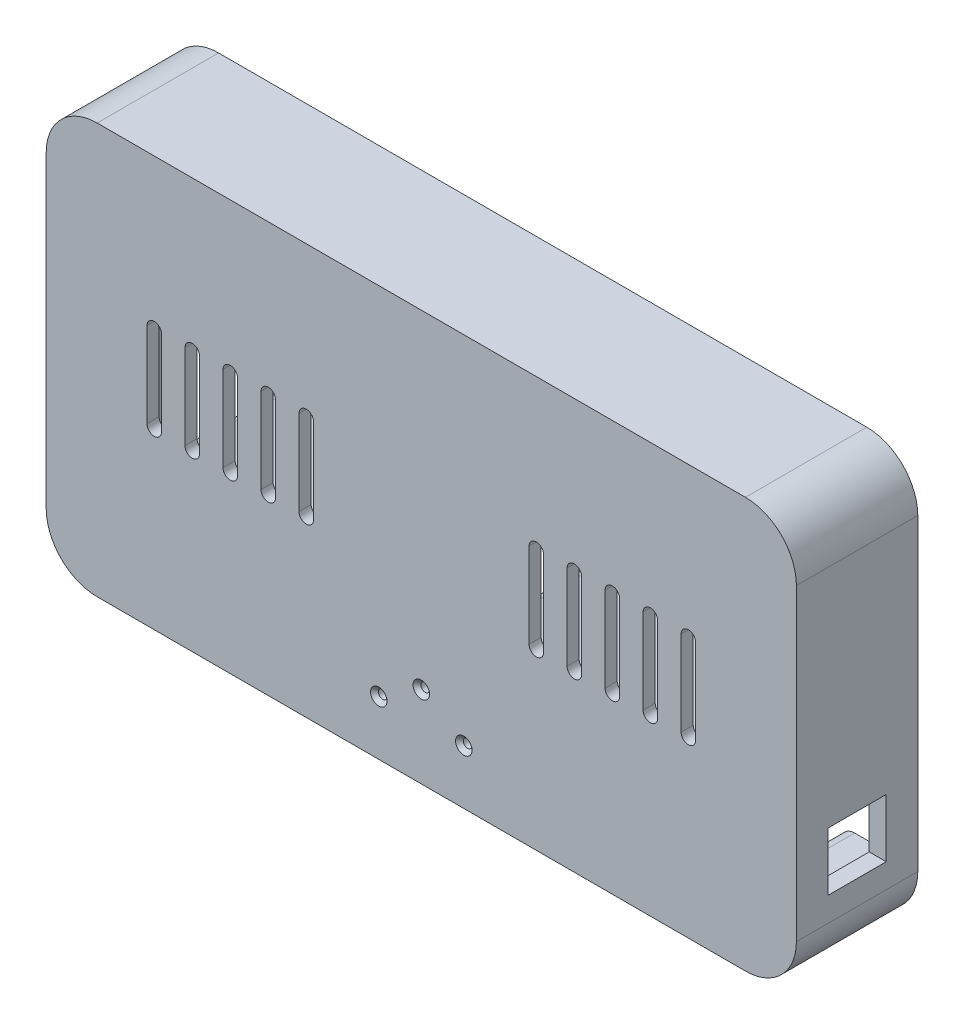
from build123d import *

# Parameters (mm, degrees)
EXTRUDE_1_DEPTH              = 50
CUT_EXTRUDE_1_DEPTH          = 45
CUT_EXTRUDE_2_DEPTH          = 5
CUT_EXTRUDE_3_DEPTH          = 5
SKETCH_1_7_R                 = 3.25
CUT_EXTRUDE_4_DEPTH          = 25
USB_REACH                    = 236.374
SKETCH_14_R                  = 1.6
SKETCH_14_W                  = 14
SKETCH_14_H                  = 9
CUT_EXTRUDE_12_REACH         = 326.224
SKETCH_16_W                  = 24
SKETCH_16_H                  = 24
CUT_EXTRUDE_13_REACH         = 326.224
SKETCH_18_W                  = 24
SKETCH_18_H                  = 24
EXTRUDE_2_DEPTH              = 40
SKETCH_29_4_R                = 2.85
EXTRUDE_4_DEPTH              = 5
SKETCH_29_5_R                = 3.4
SKETCH_29_5_R_2              = 1.2
EXTRUDE_5_DEPTH              = 6.5
CUT_EXTRUDE_START            = -2
SKETCH_29_R                  = 1.2
CUT_EXTRUDE_14_DEPTH         = 2
SKETCH_30_R                  = 1.6
CUT_EXTRUDE_21_DEPTH         = 5
HOLE_WIZARD_M3_1_D           = 3.6
HOLE_WIZARD_M3_1_CSINK_D     = 6.8
HOLE_WIZARD_M3_1_CSINK_ANGLE = 90
CUT_EXTRUDE_23_REACH         = 183.757
FILLET_1_R                   = 5


with BuildPart() as part:
    # 草图1 → 凸台-拉伸1 (new body)
    with BuildSketch(Plane.XY):
        with BuildLine():
            Line((-133.5, 84.5), (133.5, 84.5))
            ThreePointArc((133.5, 84.5), (148.349242405, 78.349242405), (154.5, 63.5))
            Line((154.5, 63.5), (154.5, -63.5))
            ThreePointArc((154.5, -63.5), (148.349242405, -78.349242405), (133.5, -84.5))
            Line((133.5, -84.5), (-133.5, -84.5))
            ThreePointArc((-133.5, -84.5), (-148.349242405, -78.349242405), (-154.5, -63.5))
            Line((-154.5, -63.5), (-154.5, 63.5))
            ThreePointArc((-154.5, 63.5), (-148.349242405, 78.349242405), (-133.5, 84.5))
        make_face()
    extrude(amount=EXTRUDE_1_DEPTH)

    # 草图1<4> → 切除-拉伸1 (cut)
    with BuildSketch(Plane.XY):
        with BuildLine():
            Line((127.75, 77.5), (-127.65, 77.5))
            Line((-127.65, 77.5), (-127.65, 63.5))
            ThreePointArc((-127.65, 63.5), (-129.36342533, 59.36342533), (-133.5, 57.65))
            Line((-133.5, 57.65), (-147.5, 57.65))
            Line((-147.5, 57.65), (-147.5, -57.65))
            Line((-147.5, -57.65), (-133.5, -57.65))
            ThreePointArc((-133.5, -57.65), (-129.36342533, -59.36342533), (-127.65, -63.5))
            Line((-127.65, -63.5), (-127.65, -77.5))
            Line((-127.65, -77.5), (127.75, -77.5))
            Line((127.75, -77.5), (127.75, -63.5))
            ThreePointArc((127.75, -63.5), (129.434136008, -59.434136008), (133.5, -57.75))
            Line((133.5, -57.75), (147.5, -57.75))
            Line((147.5, -57.75), (147.5, 57.75))
            Line((147.5, 57.75), (133.5, 57.75))
            ThreePointArc((133.5, 57.75), (129.434136008, 59.434136008), (127.75, 63.5))
            Line((127.75, 63.5), (127.75, 77.5))
        make_face()
    extrude(amount=CUT_EXTRUDE_1_DEPTH, mode=Mode.SUBTRACT)

    # 草图1<5> → 切除-拉伸2 (cut)
    with BuildSketch(Plane.XY):
        with BuildLine():
            ThreePointArc((-150.2, 63.5), (-145.308683246, 75.308683246), (-133.5, 80.2))
            Line((-133.5, 80.2), (133.5, 80.2))
            ThreePointArc((133.5, 80.2), (145.308683246, 75.308683246), (150.2, 63.5))
            Line((150.2, 63.5), (150.2, -63.5))
            ThreePointArc((150.2, -63.5), (145.308683246, -75.308683246), (133.5, -80.2))
            Line((133.5, -80.2), (-133.5, -80.2))
            ThreePointArc((-133.5, -80.2), (-145.308683246, -75.308683246), (-150.2, -63.5))
            Line((-150.2, -63.5), (-150.2, 63.5))
        make_face()
        with BuildLine():
            Line((-147.5, 63.5), (-147.5, -63.5))
            ThreePointArc((-147.5, -63.5), (-143.399494937, -73.399494937), (-133.5, -77.5))
            Line((-133.5, -77.5), (133.5, -77.5))
            ThreePointArc((133.5, -77.5), (143.399494937, -73.399494937), (147.5, -63.5))
            Line((147.5, -63.5), (147.5, 63.5))
            ThreePointArc((147.5, 63.5), (143.399494937, 73.399494937), (133.5, 77.5))
            Line((133.5, 77.5), (-133.5, 77.5))
            ThreePointArc((-133.5, 77.5), (-143.399494937, 73.399494937), (-147.5, 63.5))
        make_face(mode=Mode.SUBTRACT)
    extrude(amount=CUT_EXTRUDE_2_DEPTH, mode=Mode.SUBTRACT)

    # 草图1<6> → 切除-拉伸3 (cut)
    with BuildSketch(Plane.XY):
        with BuildLine():
            Line((-127.65, 77.5), (-133.5, 77.5))
            ThreePointArc((-133.5, 77.5), (-143.399494937, 73.399494937), (-147.5, 63.5))
            Line((-147.5, 63.5), (-147.5, 57.65))
            Line((-147.5, 57.65), (-133.5, 57.65))
            ThreePointArc((-133.5, 57.65), (-129.36342533, 59.36342533), (-127.65, 63.5))
            Line((-127.65, 63.5), (-127.65, 77.5))
        make_face()
        with BuildLine():
            Line((133.5, 77.5), (127.75, 77.5))
            Line((127.75, 77.5), (127.75, 63.5))
            ThreePointArc((127.75, 63.5), (129.434136008, 59.434136008), (133.5, 57.75))
            Line((133.5, 57.75), (147.5, 57.75))
            Line((147.5, 57.75), (147.5, 63.5))
            ThreePointArc((147.5, 63.5), (143.399494937, 73.399494937), (133.5, 77.5))
        make_face()
        with BuildLine():
            Line((-133.5, -57.65), (-147.5, -57.65))
            Line((-147.5, -57.65), (-147.5, -63.5))
            ThreePointArc((-147.5, -63.5), (-143.399494937, -73.399494937), (-133.5, -77.5))
            Line((-133.5, -77.5), (-127.65, -77.5))
            Line((-127.65, -77.5), (-127.65, -63.5))
            ThreePointArc((-127.65, -63.5), (-129.36342533, -59.36342533), (-133.5, -57.65))
        make_face()
        with BuildLine():
            Line((147.5, -63.5), (147.5, -57.75))
            Line((147.5, -57.75), (133.5, -57.75))
            ThreePointArc((133.5, -57.75), (129.434136008, -59.434136008), (127.75, -63.5))
            Line((127.75, -63.5), (127.75, -77.5))
            Line((127.75, -77.5), (133.5, -77.5))
            ThreePointArc((133.5, -77.5), (143.399494937, -73.399494937), (147.5, -63.5))
        make_face()
    extrude(amount=CUT_EXTRUDE_3_DEPTH, mode=Mode.SUBTRACT)

    # 草图1<7> → 切除-拉伸4 (cut)
    with BuildSketch(Plane.XY):
        with Locations((-133.5, -63.5)):
            Circle(SKETCH_1_7_R)
        with Locations((133.5, 63.5)):
            Circle(SKETCH_1_7_R)
        with Locations((133.5, -63.5)):
            Circle(SKETCH_1_7_R)
        with Locations((-133.5, 63.5)):
            Circle(SKETCH_1_7_R)
    extrude(amount=CUT_EXTRUDE_4_DEPTH, mode=Mode.SUBTRACT)

    # 草图14 → USB口 (cut, up to next)
    with BuildSketch(Plane.XZ.offset(84.5), mode=Mode.PRIVATE) as usb_sk1:
        with Locations(Location((92.6, 38, 0), (0, 0, 270))):
            Circle(SKETCH_14_R)
    usb_tool1 = extrude(usb_sk1.sketch, amount=-USB_REACH, mode=Mode.PRIVATE) & part.part
    # 草图14 → USB口 (cut, up to next)
    with BuildSketch(Plane.XZ.offset(84.5), mode=Mode.PRIVATE) as usb_sk2:
        with Locations(Location((74.4, 38, 0), (0, 0, 270))):
            Circle(SKETCH_14_R)
    usb_tool2 = extrude(usb_sk2.sketch, amount=-USB_REACH, mode=Mode.PRIVATE) & part.part
    # 草图14 → USB口 (cut, up to next)
    with BuildSketch(Plane.XZ.offset(84.5), mode=Mode.PRIVATE) as usb_sk3:
        with Locations((83.5, 38)):
            Rectangle(SKETCH_14_W, SKETCH_14_H)
    usb_tool3 = extrude(usb_sk3.sketch, amount=-USB_REACH, mode=Mode.PRIVATE) & part.part
    add(usb_tool1.solids().sort_by_distance((92.6, -84.5, 38))[0], mode=Mode.SUBTRACT)
    add(usb_tool2.solids().sort_by_distance((74.4, -84.5, 38))[0], mode=Mode.SUBTRACT)
    add(usb_tool3.solids().sort_by_distance((83.5, -84.5, 38))[0], mode=Mode.SUBTRACT)

    # 草图16 → 切除-拉伸12 (cut, up to next)
    with BuildSketch(Plane(origin=(154.5, 0, 0), x_dir=(0, 0, -1), z_dir=(1, 0, 0)), mode=Mode.PRIVATE) as cut_extrude_12_sk1:
        with Locations((-25, -41.5)):
            Rectangle(SKETCH_16_W, SKETCH_16_H)
    cut_extrude_12_tool1 = extrude(cut_extrude_12_sk1.sketch, amount=-CUT_EXTRUDE_12_REACH, mode=Mode.PRIVATE) & part.part
    add(cut_extrude_12_tool1.solids().sort_by_distance((154.5, -41.5, 25))[0], mode=Mode.SUBTRACT)

    # 草图18 → 切除-拉伸13 (cut, up to next)
    with BuildSketch(Plane.ZY.offset(154.5), mode=Mode.PRIVATE) as cut_extrude_13_sk1:
        with Locations((25, -41.5)):
            Rectangle(SKETCH_18_W, SKETCH_18_H)
    cut_extrude_13_tool1 = extrude(cut_extrude_13_sk1.sketch, amount=-CUT_EXTRUDE_13_REACH, mode=Mode.PRIVATE) & part.part
    add(cut_extrude_13_tool1.solids().sort_by_distance((-154.5, -41.5, 25))[0], mode=Mode.SUBTRACT)

    # 草图19 → 凸台-拉伸2 (add)
    with BuildSketch(Plane(origin=(0, 0, 45), x_dir=(-1, 0, 0), z_dir=(0, 0, -1))):
        with BuildLine():
            Line((-103, 40), (-18, 40))
            ThreePointArc((-18, 40), (-14, 36), (-18, 32))
            Line((-18, 32), (-103, 32))
            ThreePointArc((-103, 32), (-107, 36), (-103, 40))
        make_face()
        with BuildLine():
            Line((103, 40), (18, 40))
            ThreePointArc((18, 40), (14, 36), (18, 32))
            Line((18, 32), (103, 32))
            ThreePointArc((103, 32), (107, 36), (103, 40))
        make_face()
        with BuildLine():
            Line((-103, -20), (-23, -20))
            ThreePointArc((-23, -20), (-19, -24), (-23, -28))
            Line((-23, -28), (-103, -28))
            ThreePointArc((-103, -28), (-107, -24), (-103, -20))
        make_face()
        with BuildLine():
            Line((103, -20), (23, -20))
            ThreePointArc((23, -20), (19, -24), (23, -28))
            Line((23, -28), (103, -28))
            ThreePointArc((103, -28), (107, -24), (103, -20))
        make_face()
    extrude(amount=EXTRUDE_2_DEPTH)

    # 草图29<4> → 凸台-拉伸4 (add)
    with BuildSketch(Plane(origin=(0, 0, 45), x_dir=(-1, 0, 0), z_dir=(0, 0, -1))):
        with Locations(Location((-17.5, -31.85, 0), (0, 0, 180))):
            Circle(SKETCH_29_4_R)
        with Locations((17.5, -31.85)):
            Circle(SKETCH_29_4_R)
    extrude(amount=EXTRUDE_4_DEPTH)

    # 草图29<5> → 凸台-拉伸5 (add)
    # profile 1 of 4: a face of its own
    with BuildSketch(Plane(origin=(0, 0, 45), x_dir=(-1, 0, 0), z_dir=(0, 0, -1))):
        with Locations(Location((-30, 20, 0), (0, 0, 180))):
            Circle(SKETCH_29_5_R)
        with Locations(Location((-30, 20, 0), (0, 0, 180))):
            Circle(SKETCH_29_5_R_2, mode=Mode.SUBTRACT)
    # profile 2 of 4: a face of its own
    with BuildSketch(Plane(origin=(0, 0, 45), x_dir=(-1, 0, 0), z_dir=(0, 0, -1))):
        with Locations(Location((-30, -10, 0), (0, 0, 180))):
            Circle(SKETCH_29_5_R)
        with Locations(Location((-30, -10, 0), (0, 0, 180))):
            Circle(SKETCH_29_5_R_2, mode=Mode.SUBTRACT)
    # profile 3 of 4: a face of its own
    with BuildSketch(Plane(origin=(0, 0, 45), x_dir=(-1, 0, 0), z_dir=(0, 0, -1))):
        with Locations(Location((30, 20, 0), (0, 0, 180))):
            Circle(SKETCH_29_5_R)
        with Locations(Location((30, 20, 0), (0, 0, 180))):
            Circle(SKETCH_29_5_R_2, mode=Mode.SUBTRACT)
    # profile 4 of 4: a face of its own
    with BuildSketch(Plane(origin=(0, 0, 45), x_dir=(-1, 0, 0), z_dir=(0, 0, -1))):
        with Locations(Location((30, -10, 0), (0, 0, 180))):
            Circle(SKETCH_29_5_R)
        with Locations(Location((30, -10, 0), (0, 0, 180))):
            Circle(SKETCH_29_5_R_2, mode=Mode.SUBTRACT)
    extrude(amount=EXTRUDE_5_DEPTH)

    # 草图29 → 切除-拉伸14 (cut)
    with BuildSketch(Plane(origin=(0, 0, 45), x_dir=(-1, 0, 0), z_dir=(0, 0, -1)).offset(CUT_EXTRUDE_START)):
        with Locations(Location((-30, 20, 0), (0, 0, 180))):
            Circle(SKETCH_29_R)
        with Locations(Location((30, 20, 0), (0, 0, 180))):
            Circle(SKETCH_29_R)
        with Locations(Location((30, -10, 0), (0, 0, 180))):
            Circle(SKETCH_29_R)
        with Locations(Location((-30, -10, 0), (0, 0, 180))):
            Circle(SKETCH_29_R)
    extrude(amount=CUT_EXTRUDE_14_DEPTH, mode=Mode.SUBTRACT)

    # 草图30 → 切除-拉伸21 (cut)
    with BuildSketch(Plane(origin=(0, 0, 45), x_dir=(-1, 0, 0), z_dir=(0, 0, -1))):
        with Locations((17.5, -62.0866)):
            Circle(SKETCH_30_R)
        with Locations((0, -50.85)):
            Circle(SKETCH_30_R)
        with Locations((-17.5, -62.0866)):
            Circle(SKETCH_30_R)
    extrude(amount=-CUT_EXTRUDE_21_DEPTH, mode=Mode.SUBTRACT)

    # M3 平头机械螺钉的锥形沉头孔1 (through all)
    with Locations(Plane.XY.offset(50)):
        with Locations((17.5, -62.0866), (0, -50.85), (-17.5, -62.0866)):
            CounterSinkHole(HOLE_WIZARD_M3_1_D / 2, HOLE_WIZARD_M3_1_CSINK_D / 2, counter_sink_angle=HOLE_WIZARD_M3_1_CSINK_ANGLE)

    # 草图38 → 切除-拉伸23 (cut, up to next)
    with BuildSketch(Plane(origin=(0, 0, 45), x_dir=(-1, 0, 0), z_dir=(0, 0, -1)), mode=Mode.PRIVATE) as cut_extrude_23_sk1:
        with BuildLine():
            Line((-107, 22.5), (-107, -12.5))
            ThreePointArc((-107, -12.5), (-110, -15.5), (-113, -12.5))
            Line((-113, -12.5), (-113, 22.5))
            ThreePointArc((-113, 22.5), (-110, 25.5), (-107, 22.5))
        make_face()
    cut_extrude_23_tool1 = extrude(cut_extrude_23_sk1.sketch, amount=-CUT_EXTRUDE_23_REACH, mode=Mode.PRIVATE) & part.part
    # 草图38 → 切除-拉伸23 (cut, up to next)
    with BuildSketch(Plane(origin=(0, 0, 45), x_dir=(-1, 0, 0), z_dir=(0, 0, -1)), mode=Mode.PRIVATE) as cut_extrude_23_sk2:
        with BuildLine():
            Line((-97.343565249, 22.5), (-97.343565249, -12.5))
            ThreePointArc((-97.343565249, -12.5), (-94.343565249, -15.5), (-91.343565249, -12.5))
            Line((-91.343565249, -12.5), (-91.343565249, 22.5))
            ThreePointArc((-91.343565249, 22.5), (-94.343565249, 25.5), (-97.343565249, 22.5))
        make_face()
    cut_extrude_23_tool2 = extrude(cut_extrude_23_sk2.sketch, amount=-CUT_EXTRUDE_23_REACH, mode=Mode.PRIVATE) & part.part
    # 草图38 → 切除-拉伸23 (cut, up to next)
    with BuildSketch(Plane(origin=(0, 0, 45), x_dir=(-1, 0, 0), z_dir=(0, 0, -1)), mode=Mode.PRIVATE) as cut_extrude_23_sk3:
        with BuildLine():
            Line((-81.687130498, 22.5), (-81.687130498, -12.5))
            ThreePointArc((-81.687130498, -12.5), (-78.687130498, -15.5), (-75.687130498, -12.5))
            Line((-75.687130498, -12.5), (-75.687130498, 22.5))
            ThreePointArc((-75.687130498, 22.5), (-78.687130498, 25.5), (-81.687130498, 22.5))
        make_face()
    cut_extrude_23_tool3 = extrude(cut_extrude_23_sk3.sketch, amount=-CUT_EXTRUDE_23_REACH, mode=Mode.PRIVATE) & part.part
    # 草图38 → 切除-拉伸23 (cut, up to next)
    with BuildSketch(Plane(origin=(0, 0, 45), x_dir=(-1, 0, 0), z_dir=(0, 0, -1)), mode=Mode.PRIVATE) as cut_extrude_23_sk4:
        with BuildLine():
            Line((-66.030695747, 22.5), (-66.030695747, -12.5))
            ThreePointArc((-66.030695747, -12.5), (-63.030695747, -15.5), (-60.030695747, -12.5))
            Line((-60.030695747, -12.5), (-60.030695747, 22.5))
            ThreePointArc((-60.030695747, 22.5), (-63.030695747, 25.5), (-66.030695747, 22.5))
        make_face()
    cut_extrude_23_tool4 = extrude(cut_extrude_23_sk4.sketch, amount=-CUT_EXTRUDE_23_REACH, mode=Mode.PRIVATE) & part.part
    # 草图38 → 切除-拉伸23 (cut, up to next)
    with BuildSketch(Plane(origin=(0, 0, 45), x_dir=(-1, 0, 0), z_dir=(0, 0, -1)), mode=Mode.PRIVATE) as cut_extrude_23_sk5:
        with BuildLine():
            Line((-50.374260997, 22.5), (-50.374260997, -12.5))
            ThreePointArc((-50.374260997, -12.5), (-47.374260997, -15.5), (-44.374260997, -12.5))
            Line((-44.374260997, -12.5), (-44.374260997, 22.5))
            ThreePointArc((-44.374260997, 22.5), (-47.374260997, 25.5), (-50.374260997, 22.5))
        make_face()
    cut_extrude_23_tool5 = extrude(cut_extrude_23_sk5.sketch, amount=-CUT_EXTRUDE_23_REACH, mode=Mode.PRIVATE) & part.part
    # 草图38 → 切除-拉伸23 (cut, up to next)
    with BuildSketch(Plane(origin=(0, 0, 45), x_dir=(-1, 0, 0), z_dir=(0, 0, -1)), mode=Mode.PRIVATE) as cut_extrude_23_sk6:
        with BuildLine():
            Line((107, 22.5), (107, -12.5))
            ThreePointArc((107, -12.5), (110, -15.5), (113, -12.5))
            Line((113, -12.5), (113, 22.5))
            ThreePointArc((113, 22.5), (110, 25.5), (107, 22.5))
        make_face()
    cut_extrude_23_tool6 = extrude(cut_extrude_23_sk6.sketch, amount=-CUT_EXTRUDE_23_REACH, mode=Mode.PRIVATE) & part.part
    # 草图38 → 切除-拉伸23 (cut, up to next)
    with BuildSketch(Plane(origin=(0, 0, 45), x_dir=(-1, 0, 0), z_dir=(0, 0, -1)), mode=Mode.PRIVATE) as cut_extrude_23_sk7:
        with BuildLine():
            Line((91.343565249, 22.5), (91.343565249, -12.5))
            ThreePointArc((91.343565249, -12.5), (94.343565249, -15.5), (97.343565249, -12.5))
            Line((97.343565249, -12.5), (97.343565249, 22.5))
            ThreePointArc((97.343565249, 22.5), (94.343565249, 25.5), (91.343565249, 22.5))
        make_face()
    cut_extrude_23_tool7 = extrude(cut_extrude_23_sk7.sketch, amount=-CUT_EXTRUDE_23_REACH, mode=Mode.PRIVATE) & part.part
    # 草图38 → 切除-拉伸23 (cut, up to next)
    with BuildSketch(Plane(origin=(0, 0, 45), x_dir=(-1, 0, 0), z_dir=(0, 0, -1)), mode=Mode.PRIVATE) as cut_extrude_23_sk8:
        with BuildLine():
            Line((75.687130498, 22.5), (75.687130498, -12.5))
            ThreePointArc((75.687130498, -12.5), (78.687130498, -15.5), (81.687130498, -12.5))
            Line((81.687130498, -12.5), (81.687130498, 22.5))
            ThreePointArc((81.687130498, 22.5), (78.687130498, 25.5), (75.687130498, 22.5))
        make_face()
    cut_extrude_23_tool8 = extrude(cut_extrude_23_sk8.sketch, amount=-CUT_EXTRUDE_23_REACH, mode=Mode.PRIVATE) & part.part
    # 草图38 → 切除-拉伸23 (cut, up to next)
    with BuildSketch(Plane(origin=(0, 0, 45), x_dir=(-1, 0, 0), z_dir=(0, 0, -1)), mode=Mode.PRIVATE) as cut_extrude_23_sk9:
        with BuildLine():
            Line((60.030695747, 22.5), (60.030695747, -12.5))
            ThreePointArc((60.030695747, -12.5), (63.030695747, -15.5), (66.030695747, -12.5))
            Line((66.030695747, -12.5), (66.030695747, 22.5))
            ThreePointArc((66.030695747, 22.5), (63.030695747, 25.5), (60.030695747, 22.5))
        make_face()
    cut_extrude_23_tool9 = extrude(cut_extrude_23_sk9.sketch, amount=-CUT_EXTRUDE_23_REACH, mode=Mode.PRIVATE) & part.part
    # 草图38 → 切除-拉伸23 (cut, up to next)
    with BuildSketch(Plane(origin=(0, 0, 45), x_dir=(-1, 0, 0), z_dir=(0, 0, -1)), mode=Mode.PRIVATE) as cut_extrude_23_sk10:
        with BuildLine():
            Line((44.374260997, 22.5), (44.374260997, -12.5))
            ThreePointArc((44.374260997, -12.5), (47.374260997, -15.5), (50.374260997, -12.5))
            Line((50.374260997, -12.5), (50.374260997, 22.5))
            ThreePointArc((50.374260997, 22.5), (47.374260997, 25.5), (44.374260997, 22.5))
        make_face()
    cut_extrude_23_tool10 = extrude(cut_extrude_23_sk10.sketch, amount=-CUT_EXTRUDE_23_REACH, mode=Mode.PRIVATE) & part.part
    add(cut_extrude_23_tool1.solids().sort_by_distance((110, 5, 45))[0], mode=Mode.SUBTRACT)
    add(cut_extrude_23_tool2.solids().sort_by_distance((94.343565, 5, 45))[0], mode=Mode.SUBTRACT)
    add(cut_extrude_23_tool3.solids().sort_by_distance((78.68713, 5, 45))[0], mode=Mode.SUBTRACT)
    add(cut_extrude_23_tool4.solids().sort_by_distance((63.030696, 5, 45))[0], mode=Mode.SUBTRACT)
    add(cut_extrude_23_tool5.solids().sort_by_distance((47.374261, 5, 45))[0], mode=Mode.SUBTRACT)
    add(cut_extrude_23_tool6.solids().sort_by_distance((-110, 5, 45))[0], mode=Mode.SUBTRACT)
    add(cut_extrude_23_tool7.solids().sort_by_distance((-94.343565, 5, 45))[0], mode=Mode.SUBTRACT)
    add(cut_extrude_23_tool8.solids().sort_by_distance((-78.68713, 5, 45))[0], mode=Mode.SUBTRACT)
    add(cut_extrude_23_tool9.solids().sort_by_distance((-63.030696, 5, 45))[0], mode=Mode.SUBTRACT)
    add(cut_extrude_23_tool10.solids().sort_by_distance((-47.374261, 5, 45))[0], mode=Mode.SUBTRACT)

    # 圆角1
    fillet_1_edges = [part.edges().sort_by_distance(p)[0] for p in [
        (26.6, 20, 45),
        (26.6, -10, 45),
        (-33.4, 20, 45),
        (-33.4, -10, 45),
    ]]
    fillet(fillet_1_edges, radius=FILLET_1_R)


solid = part.part
